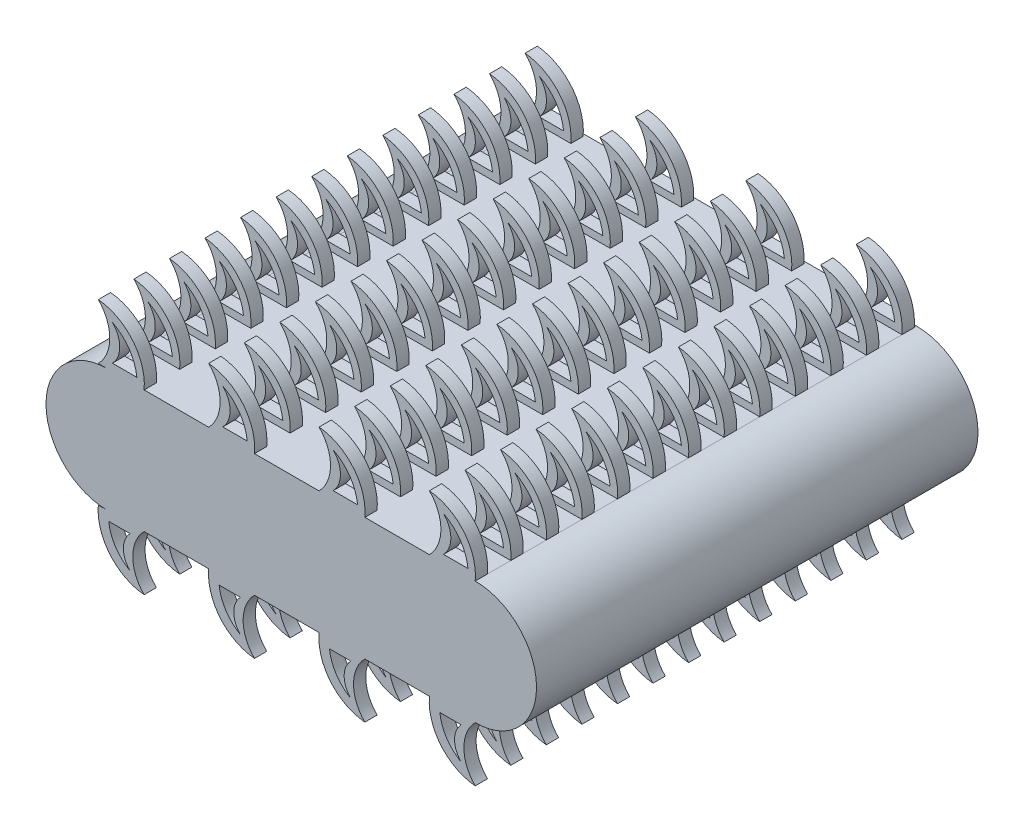
from build123d import *

# Parameters (mm, degrees)
BOSS_EXTRUDE1_DEPTH = 360
BOSS_EXTRUDE2_DEPTH = 10
LPATTERN1_COUNT     = 13
LPATTERN1_PITCH     = 29
CUT_EXTRUDE1_DEPTH  = 360
BOSS_EXTRUDE3_DEPTH = 10
LPATTERN2_COUNT     = 13
LPATTERN2_PITCH     = 29


with BuildPart() as part:
    # Sketch1 → Boss-Extrude1 (new body)
    with BuildSketch(Plane.XY):
        with BuildLine():
            Line((0, 50), (300, 50))
            ThreePointArc((300, 50), (350, 0), (300, -50))
            Line((300, -50), (0, -50))
            ThreePointArc((0, -50), (-50, 0), (0, 50))
        make_face()
    extrude(amount=BOSS_EXTRUDE1_DEPTH)

    # Sketch2 → Boss-Extrude2 (add)
    with BuildSketch(Plane.XY.offset(360)):
        with BuildLine():
            Line((300, 50), (262.650423352, 50))
            ThreePointArc((262.650423352, 50), (271.994437706, 72.558446181), (262.650423352, 95.116892361))
            ThreePointArc((262.650423352, 95.116892361), (290.66922603, 80.293796779), (300, 50))
        make_face()
        with BuildLine():
            Line((210, 50), (172.650423352, 50))
            ThreePointArc((172.650423352, 50), (181.994437706, 72.558446181), (172.650423352, 95.116892361))
            ThreePointArc((172.650423352, 95.116892361), (200.66922603, 80.293796779), (210, 50))
        make_face()
        with BuildLine():
            Line((120, 50), (82.650423352, 50))
            ThreePointArc((82.650423352, 50), (91.994437706, 72.558446181), (82.650423352, 95.116892361))
            ThreePointArc((82.650423352, 95.116892361), (110.66922603, 80.293796779), (120, 50))
        make_face()
        with BuildLine():
            Line((30, 50), (-7.349576648, 50))
            ThreePointArc((-7.349576648, 50), (1.994437706, 72.558446181), (-7.349576648, 95.116892361))
            ThreePointArc((-7.349576648, 95.116892361), (20.66922603, 80.293796779), (30, 50))
        make_face()
    boss_extrude2 = extrude(amount=-BOSS_EXTRUDE2_DEPTH)

    # LPattern1: Boss-Extrude2 ×13
    with Locations(*[(0, 0, -i * LPATTERN1_PITCH) for i in range(1, LPATTERN1_COUNT)]):
        add(boss_extrude2)

    # Sketch3 → Cut-Extrude1 (cut)
    with BuildSketch(Plane.XY.offset(360)):
        with BuildLine():
            Line((274.128013656, 55.928477249), (294.107522704, 55.928477249))
            ThreePointArc((294.107522704, 55.928477249), (287.779139448, 72.912392784), (274.128013656, 84.835000977))
            ThreePointArc((274.128013656, 84.835000977), (280.114750741, 70.381739113), (274.128013656, 55.928477249))
        make_face()
        with BuildLine():
            Line((184.128013656, 55.928477249), (204.107522704, 55.928477249))
            ThreePointArc((204.107522704, 55.928477249), (197.779139448, 72.912392784), (184.128013656, 84.835000977))
            ThreePointArc((184.128013656, 84.835000977), (190.114750741, 70.381739113), (184.128013656, 55.928477249))
        make_face()
        with BuildLine():
            Line((94.128013656, 55.928477249), (114.107522704, 55.928477249))
            ThreePointArc((114.107522704, 55.928477249), (107.779139448, 72.912392784), (94.128013656, 84.835000977))
            ThreePointArc((94.128013656, 84.835000977), (100.114750741, 70.381739113), (94.128013656, 55.928477249))
        make_face()
        with BuildLine():
            Line((4.128013656, 55.928477249), (24.107522704, 55.928477249))
            ThreePointArc((24.107522704, 55.928477249), (17.779139448, 72.912392784), (4.128013656, 84.835000977))
            ThreePointArc((4.128013656, 84.835000977), (10.114750741, 70.381739113), (4.128013656, 55.928477249))
        make_face()
    extrude(amount=-CUT_EXTRUDE1_DEPTH, mode=Mode.SUBTRACT)

    # Sketch4 → Boss-Extrude3 (add)
    # profile 1 of 4: a face of its own
    with BuildSketch(Plane.XY.offset(360)):
        with BuildLine():
            Line((262.650423352, -50), (300, -50))
            ThreePointArc((300, -50), (290.756384578, -72.316061718), (300, -94.632123435))
            ThreePointArc((300, -94.632123435), (272.081596254, -80.051412316), (262.650423352, -50))
        make_face()
        with BuildLine():
            Line((271.152342096, -57.223680963), (288.58127552, -57.223680963))
            ThreePointArc((288.58127552, -57.223680963), (283.122779943, -70.401655016), (288.58127552, -83.579629068))
            ThreePointArc((288.58127552, -83.579629068), (276.688299524, -72.503572446), (271.152342096, -57.223680963))
        make_face(mode=Mode.SUBTRACT)
    # profile 2 of 4: a face of its own
    with BuildSketch(Plane.XY.offset(360)):
        with BuildLine():
            Line((172.650423352, -50), (210, -50))
            ThreePointArc((210, -50), (200.756384578, -72.316061718), (210, -94.632123435))
            ThreePointArc((210, -94.632123435), (182.081596254, -80.051412316), (172.650423352, -50))
        make_face()
        with BuildLine():
            Line((181.152342096, -57.223680963), (198.58127552, -57.223680963))
            ThreePointArc((198.58127552, -57.223680963), (193.122779943, -70.401655016), (198.58127552, -83.579629068))
            ThreePointArc((198.58127552, -83.579629068), (186.688299524, -72.503572446), (181.152342096, -57.223680963))
        make_face(mode=Mode.SUBTRACT)
    # profile 3 of 4: a face of its own
    with BuildSketch(Plane.XY.offset(360)):
        with BuildLine():
            Line((82.650423352, -50), (120, -50))
            ThreePointArc((120, -50), (110.756384578, -72.316061718), (120, -94.632123435))
            ThreePointArc((120, -94.632123435), (92.081596254, -80.051412316), (82.650423352, -50))
        make_face()
        with BuildLine():
            Line((91.152342096, -57.223680963), (108.58127552, -57.223680963))
            ThreePointArc((108.58127552, -57.223680963), (103.122779943, -70.401655016), (108.58127552, -83.579629068))
            ThreePointArc((108.58127552, -83.579629068), (96.688299524, -72.503572446), (91.152342096, -57.223680963))
        make_face(mode=Mode.SUBTRACT)
    # profile 4 of 4: a face of its own
    with BuildSketch(Plane.XY.offset(360)):
        with BuildLine():
            Line((-7.349576648, -50), (30, -50))
            ThreePointArc((30, -50), (20.756384578, -72.316061718), (30, -94.632123435))
            ThreePointArc((30, -94.632123435), (2.081596254, -80.051412316), (-7.349576648, -50))
        make_face()
        with BuildLine():
            Line((1.152342096, -57.223680963), (18.58127552, -57.223680963))
            ThreePointArc((18.58127552, -57.223680963), (13.122779943, -70.401655016), (18.58127552, -83.579629068))
            ThreePointArc((18.58127552, -83.579629068), (6.688299524, -72.503572446), (1.152342096, -57.223680963))
        make_face(mode=Mode.SUBTRACT)
    boss_extrude3 = extrude(amount=-BOSS_EXTRUDE3_DEPTH)

    # LPattern2: Boss-Extrude3 ×13
    with Locations(*[(0, 0, -i * LPATTERN2_PITCH) for i in range(1, LPATTERN2_COUNT)]):
        add(boss_extrude3)


solid = part.part
